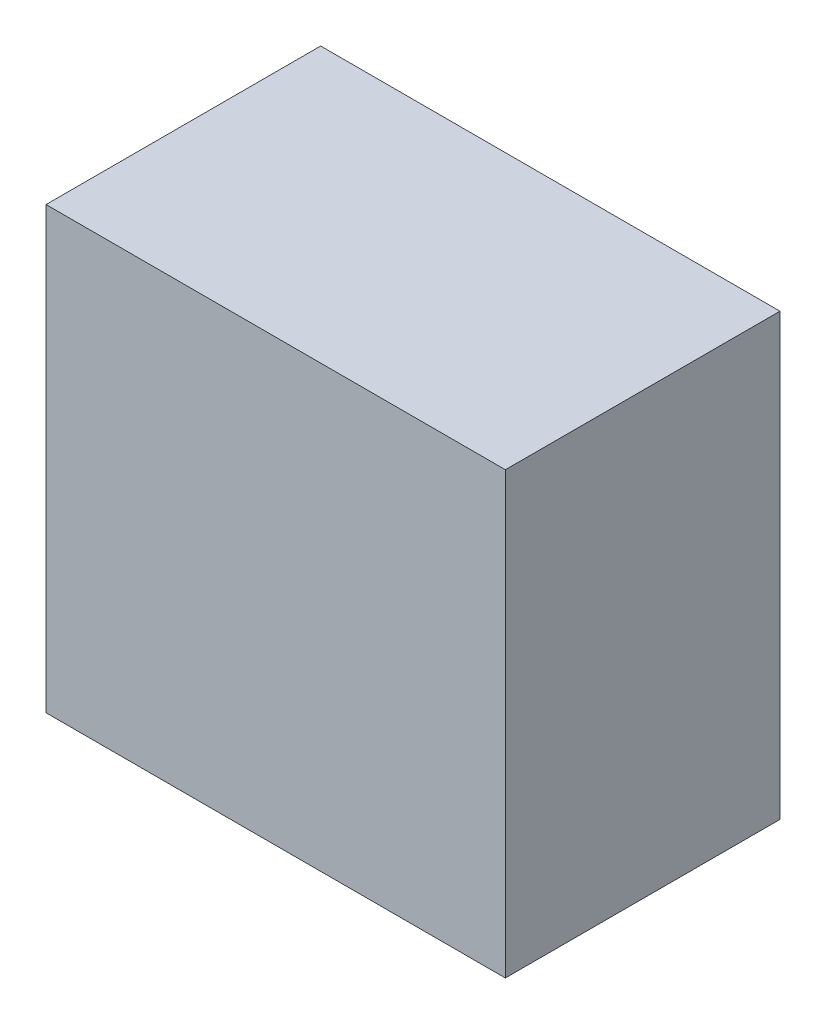
from build123d import *

# Parameters (mm, degrees)
ESQUISSE1_W             = 15.054
ESQUISSE1_H             = 14.427
COMPONENT_OUTLINE_DEPTH = 9


with BuildPart() as part:
    # Esquisse1 → Component_Outline (new body)
    with BuildSketch(Plane.XY):
        with Locations((0, -3.1035)):
            Rectangle(ESQUISSE1_W, ESQUISSE1_H)
    extrude(amount=COMPONENT_OUTLINE_DEPTH)


solid = part.part
